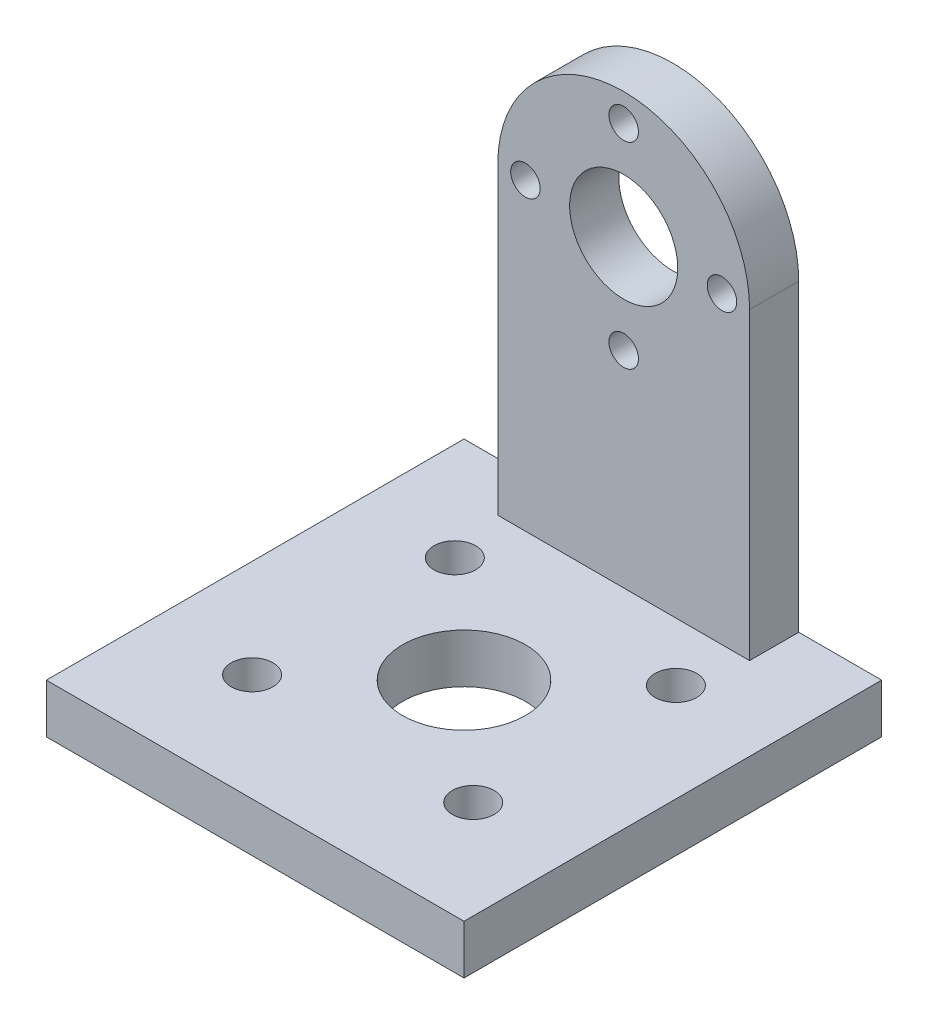
from build123d import *

# Parameters (mm, degrees)
SKETCH1_R           = 1.2
SKETCH1_R_2         = 4.4
BOSS_EXTRUDE1_DEPTH = 4
SKETCH3_W           = 34
SKETCH3_H           = 34
SKETCH3_R           = 5
SKETCH3_R_2         = 1.7
BOSS_EXTRUDE3_DEPTH = 4


with BuildPart() as part:
    # Sketch1 → Boss-Extrude1 (new body)
    with BuildSketch(Plane.XY):
        with BuildLine():
            Line((-10.25, -28.75), (10.25, -28.75))
            Line((10.25, -28.75), (10.25, 0))
            ThreePointArc((10.25, 0), (0, 10.25), (-10.25, 0))
            Line((-10.25, 0), (-10.25, -28.75))
        make_face()
        with Locations((0, 8)):
            Circle(SKETCH1_R, mode=Mode.SUBTRACT)
        with Locations((-8, 0)):
            Circle(SKETCH1_R, mode=Mode.SUBTRACT)
        with Locations((0, -8)):
            Circle(SKETCH1_R, mode=Mode.SUBTRACT)
        with Locations((8, 0)):
            Circle(SKETCH1_R, mode=Mode.SUBTRACT)
        Circle(SKETCH1_R_2, mode=Mode.SUBTRACT)
    extrude(amount=BOSS_EXTRUDE1_DEPTH)

    # Sketch3 → Boss-Extrude3 (add)
    with BuildSketch(Plane(origin=(0, -28.75, 0), x_dir=(-1, 0, 0), z_dir=(0, -1, 0))):
        with Locations((0, -17)):
            Rectangle(SKETCH3_W, SKETCH3_H)
        with Locations(Location((0, -17, 0), (0, 0, 180))):
            Circle(SKETCH3_R, mode=Mode.SUBTRACT)
        with Locations(Location((-9, -8.75, 0), (0, 0, 180))):
            Circle(SKETCH3_R_2, mode=Mode.SUBTRACT)
        with Locations(Location((9, -8.75, 0), (0, 0, 180))):
            Circle(SKETCH3_R_2, mode=Mode.SUBTRACT)
        with Locations(Location((9, -25.25, 0), (0, 0, 180))):
            Circle(SKETCH3_R_2, mode=Mode.SUBTRACT)
        with Locations(Location((-9, -25.25, 0), (0, 0, 180))):
            Circle(SKETCH3_R_2, mode=Mode.SUBTRACT)
    extrude(amount=-BOSS_EXTRUDE3_DEPTH)


solid = part.part
